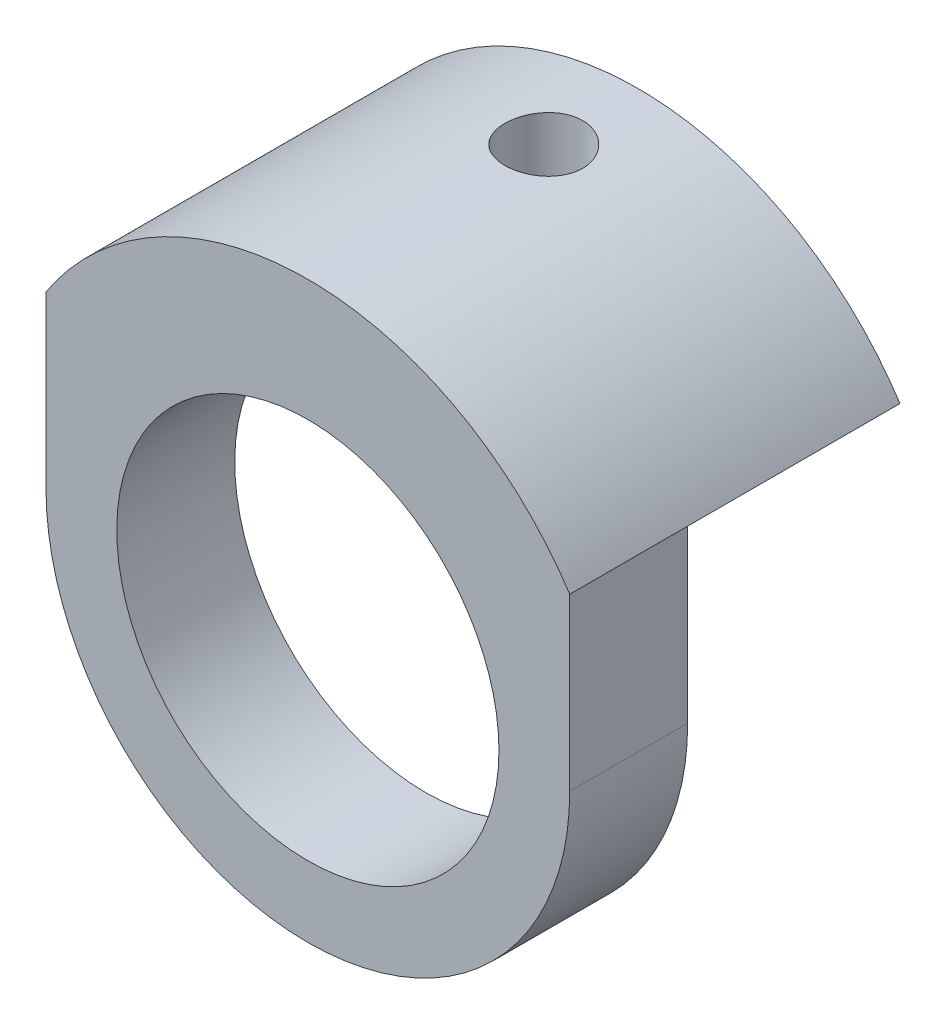
from build123d import *

# Parameters (mm, degrees)
SKETCH1_R               = 8.1
BOSS_EXTRUDE1_DEPTH     = 14
CUT_EXTRUDE1_REACH      = 31.401
SKETCH2_W               = 9
SKETCH2_H               = 18.335502747
CUT_EXTRUDE2_REACH      = 27.601
CUT_EXTRUDE2_END_RADIUS = 13.25
SKETCH3_R               = 1.65
CUT_EXTRUDE3_DEPTH      = 3


with BuildPart() as part:
    # Sketch1 → Boss-Extrude1 (new body)
    with BuildSketch(Plane.XY):
        with BuildLine():
            ThreePointArc((-11.1, 0), (0, -11.1), (11.1, 0))
            Line((11.1, 0), (11.1, 7.235502747))
            ThreePointArc((11.1, 7.235502747), (0, 13.25), (-11.1, 7.235502747))
            Line((-11.1, 7.235502747), (-11.1, 0))
        make_face()
        Circle(SKETCH1_R, mode=Mode.SUBTRACT)
    extrude(amount=BOSS_EXTRUDE1_DEPTH)

    # Cut-Extrude1: up to this face of the body (flat: up to its plane)
    cut_extrude1_end = Plane(part.part.faces().sort_by_distance((11.1, 3.617751373, 7))[0])
    # Sketch2 → Cut-Extrude1 (cut, up to the picked face)
    with BuildSketch(Plane.ZY.offset(11.1), mode=Mode.PRIVATE) as cut_extrude1_sk1:
        with Locations((4.5, -1.932248627)):
            Rectangle(SKETCH2_W, SKETCH2_H)
    cut_extrude1_tool1 = split(extrude(cut_extrude1_sk1.sketch, amount=-CUT_EXTRUDE1_REACH, mode=Mode.PRIVATE), bisect_by=cut_extrude1_end, keep=Keep.BOTH, mode=Mode.PRIVATE)
    add(cut_extrude1_tool1.solids().sort_by(Axis((-11.1, -1.932249, 4.5), (1, 0, 0)))[0], mode=Mode.SUBTRACT)

    # Cut-Extrude2: up to this cylinder (the profile starts inside it)
    cut_extrude2_end = Plane(origin=(0, 0, 4), z_dir=(0, 0, -1)) * Cylinder(CUT_EXTRUDE2_END_RADIUS, 82.702, mode=Mode.PRIVATE)
    # Sketch3 → Cut-Extrude2 (cut, up to the surface)
    with BuildSketch(Plane.XZ.offset(-7.235502747), mode=Mode.PRIVATE) as cut_extrude2_sk1:
        with Locations((0, 4)):
            Circle(SKETCH3_R)
    cut_extrude2_tool1 = extrude(cut_extrude2_sk1.sketch, amount=-CUT_EXTRUDE2_REACH, mode=Mode.PRIVATE) & cut_extrude2_end
    add(cut_extrude2_tool1.solids().sort_by_distance((0, 7.235503, 4))[0], mode=Mode.SUBTRACT)

    # Sketch4 → Cut-Extrude3 (cut)
    with BuildSketch(Plane.XZ.offset(-7.235502747)):
        Polygon((1.616580754, 6.8), (-1.616580754, 6.8), (-3.233161507, 4), (-1.616580754, 1.2), (1.616580754, 1.2), (3.233161507, 4), align=None)
    extrude(amount=-CUT_EXTRUDE3_DEPTH, mode=Mode.SUBTRACT)


solid = part.part
